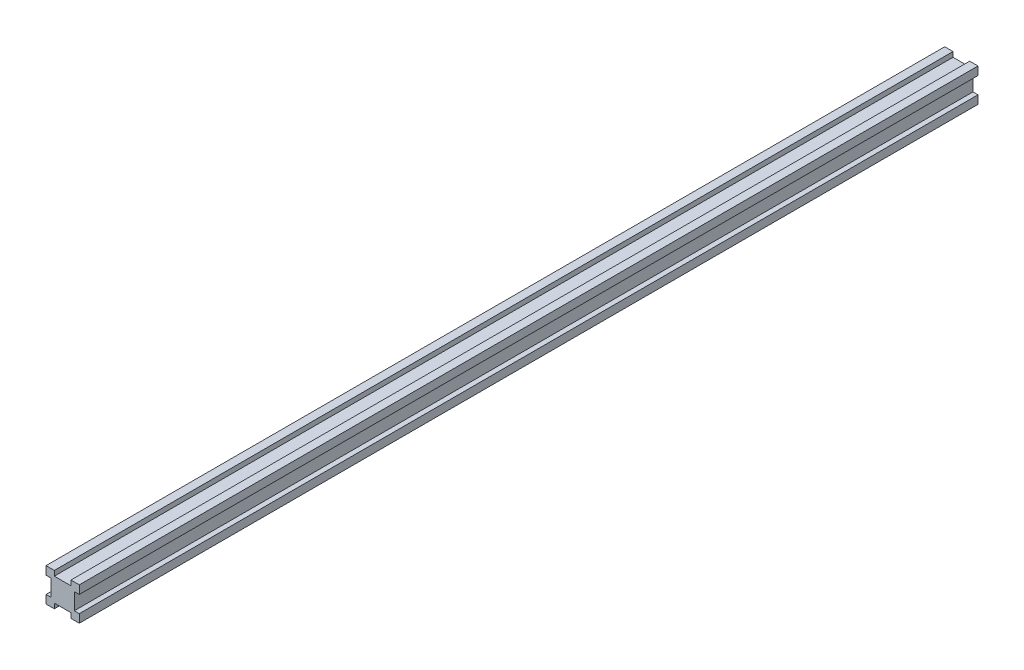
from build123d import *

# Parameters (mm, degrees)
EXTRUDE_1_DEPTH = 270


with BuildPart() as part:
    # 草图1 → 凸台-拉伸1 (new, symmetric)
    with BuildSketch(Plane.XY):
        Polygon((-5, 7), (-5, 10), (-10, 10), (-10, 5), (-7, 5), (-7, -5), (-10, -5), (-10, -10), (-5, -10), (-5, -7), (5, -7), (5, -10), (10, -10), (10, -5), (7, -5), (7, 5), (10, 5), (10, 10), (5, 10), (5, 7), align=None)
    extrude(amount=EXTRUDE_1_DEPTH, both=True)


solid = part.part
